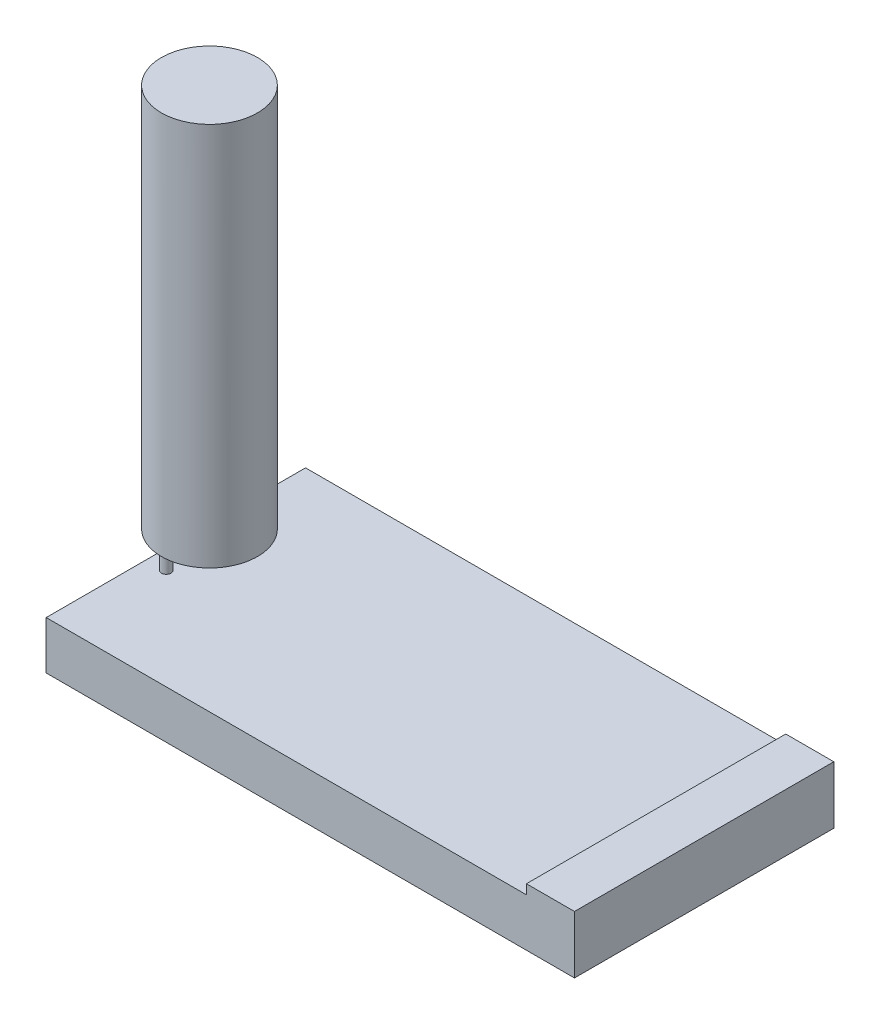
from build123d import *

# Parameters (mm, degrees)
SKETCH_1_W      = 27.5
SKETCH_1_H      = 13.5
EXTRUDE_1_DEPTH = 2.5
SKETCH_2_W      = 2.5
SKETCH_2_H      = 13.5
EXTRUDE_2_DEPTH = 3
SKETCH_5_R      = 0.25
EXTRUDE_6_DEPTH = 3
SKETCH_6_R      = 2.5
EXTRUDE_7_DEPTH = 20


with BuildPart() as part:
    # Эскиз1 → Бобышка-Вытянуть1 (new body)
    with BuildSketch(Plane(origin=(0, 0, 0), x_dir=(1, 0, 0), z_dir=(0, 1, 0))):
        Rectangle(SKETCH_1_W, SKETCH_1_H)
    extrude(amount=EXTRUDE_1_DEPTH)

    # Эскиз2 → Бобышка-Вытянуть2 (add)
    with BuildSketch(Plane.XZ):
        with Locations((12.5, 0)):
            Rectangle(SKETCH_2_W, SKETCH_2_H)
    extrude(amount=-EXTRUDE_2_DEPTH)

    # Эскиз5 → Бобышка-Вытянуть6 (add)
    with BuildSketch(Plane(origin=(0, 2.5, 0), x_dir=(1, 0, 0), z_dir=(0, 1, 0))):
        with Locations(Location((-12.75, -1.5, 0), (0, 0, 90))):
            Circle(SKETCH_5_R)
    extrude(amount=EXTRUDE_6_DEPTH)

    # Эскиз6 → Бобышка-Вытянуть7 (add)
    with BuildSketch(Plane(origin=(0, 5.5, 0), x_dir=(1, 0, 0), z_dir=(0, 1, 0))):
        with Locations(Location((-10.5, -1.5, 0), (0, 0, 180))):
            Circle(SKETCH_6_R)
    extrude(amount=EXTRUDE_7_DEPTH)


solid = part.part
